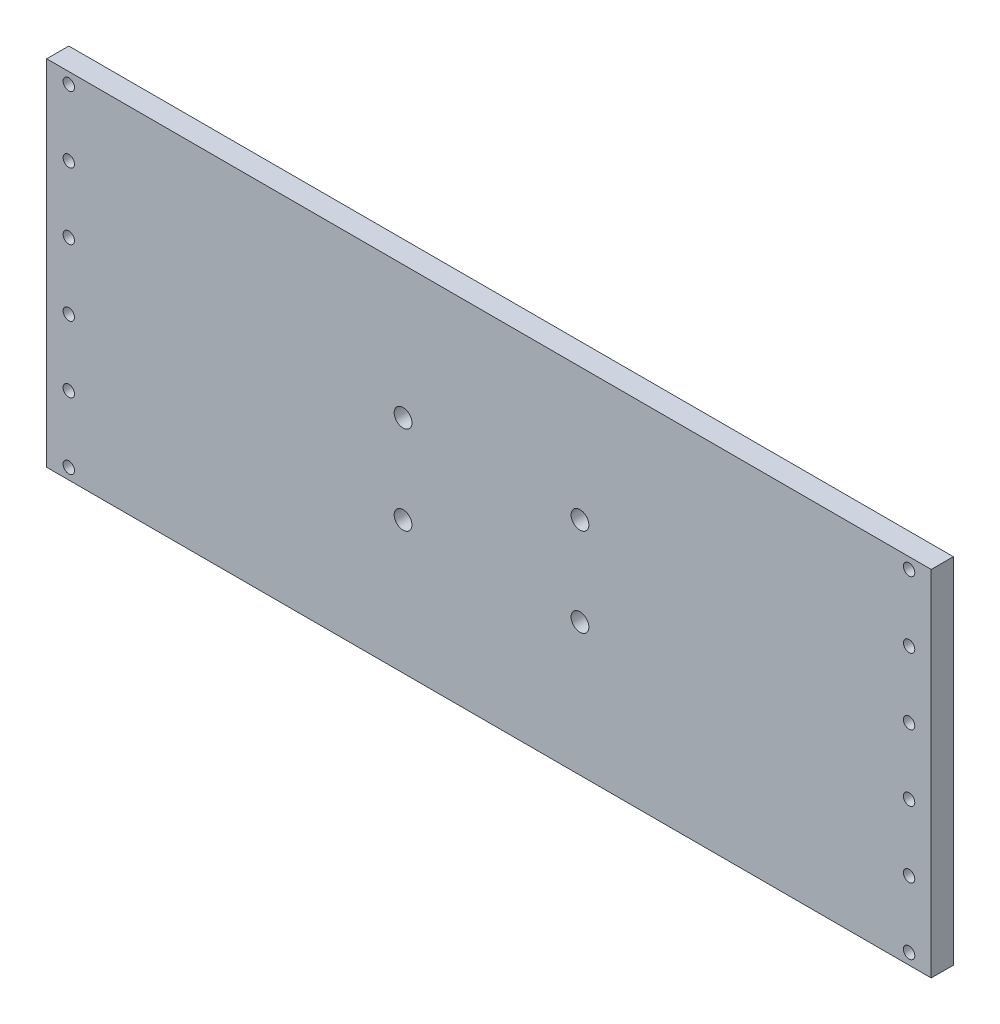
from build123d import *

# Parameters (mm, degrees)
SKETCH1_W              = 254
SKETCH1_H              = 101.6
BOSS_EXTRUDE1_DEPTH    = 3.175
F_4_CLEARANCE_HOLE1_D  = 3.2639
F_10_CLEARANCE_HOLE1_D = 5.1054


with BuildPart() as part:
    # Sketch1 → Boss-Extrude1 (new, symmetric)
    with BuildSketch(Plane.XY):
        Rectangle(SKETCH1_W, SKETCH1_H)
    extrude(amount=BOSS_EXTRUDE1_DEPTH, both=True)

    # #4 Clearance Hole1 (through all)
    with Locations(Plane.XY.offset(3.175)):
        with Locations((-120.65, 47.625), (-120.65, 28.575), (-120.65, 9.525), (-120.65, -9.525), (-120.65, -28.575), (-120.65, -47.625)):
            f_4_clearance_hole1 = Hole(F_4_CLEARANCE_HOLE1_D / 2)

    # Mirror1: #4 Clearance Hole1 across plane
    add(f_4_clearance_hole1.mirror(Plane(origin=(0, 0, 0), x_dir=(0, 0, 1), z_dir=(1, 0, 0))), mode=Mode.SUBTRACT)

    # #10 Clearance Hole1 (through all)
    with Locations(Plane.XY.offset(3.175)):
        with Locations((-24.659484021, 12.7), (26.140515979, 12.7), (26.140515979, -12.7), (-24.659484021, -12.7)):
            Hole(F_10_CLEARANCE_HOLE1_D / 2)


solid = part.part
